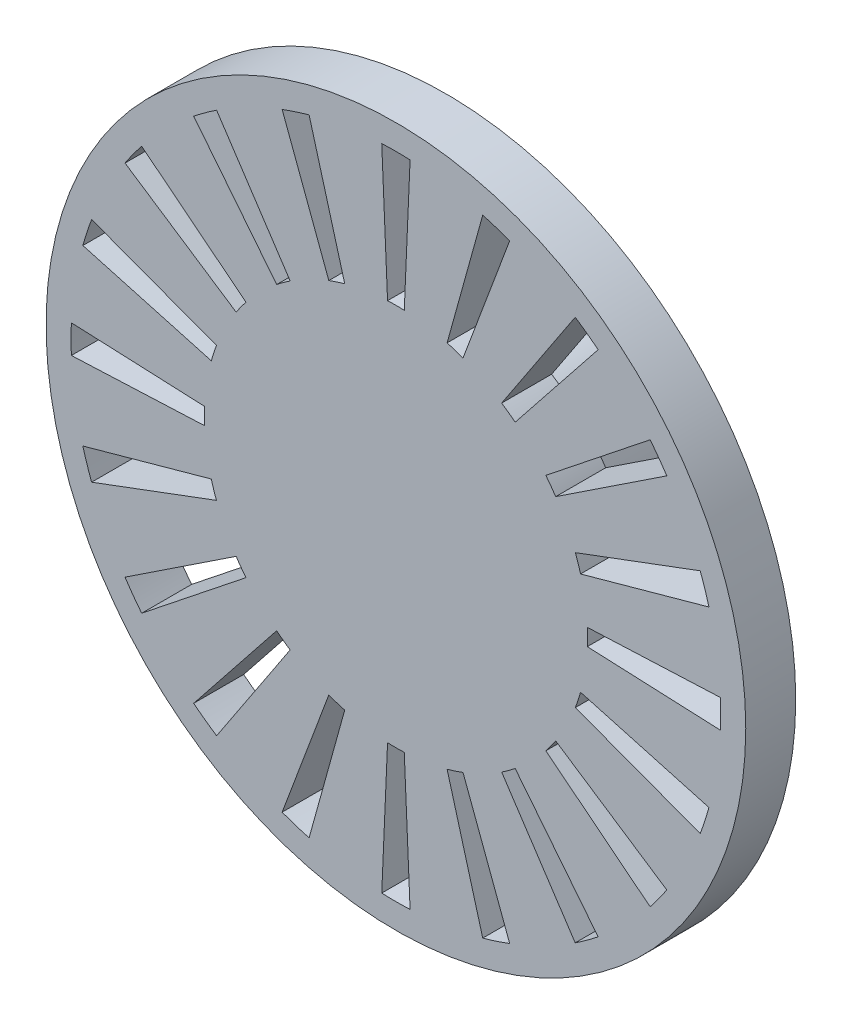
from build123d import *

# Parameters (mm, degrees)
ESBO_O1_R                = 21
RESSALTO_EXTRUS_O1_DEPTH = 3
CORTE_EXTRUS_O1_DEPTH    = 30.849623113
PADR_OCIRCULAR1_COUNT    = 20
ESBO_O7_R                = 6
RESSALTO_EXTRUS_O2_DEPTH = 10
CHANFRO1_SIZE            = 3
ESBO_O8_R                = 1.3
CORTE_EXTRUS_O3_DEPTH    = 12


with BuildPart() as part:
    # Esboço1 → Ressalto-extrusão1 (new body)
    with BuildSketch(Plane.XY):
        Circle(ESBO_O1_R)
    extrude(amount=RESSALTO_EXTRUS_O1_DEPTH)

    # Esboço5 → Corte-extrusão1 (cut, through all)
    with BuildSketch(Plane.XY.offset(3)):
        with BuildLine():
            Line((-0.501622955, 11.489054548), (-0.850578054, 19.481440321))
            ThreePointArc((-0.850578054, 19.481440321), (0, 19.5), (0.850578054, 19.481440321))
            Line((0.850578054, 19.481440321), (0.501622955, 11.489054548))
            ThreePointArc((0.501622955, 11.489054548), (0, 11.5), (-0.501622955, 11.489054548))
        make_face()
    corte_extrus_o1 = extrude(amount=-CORTE_EXTRUS_O1_DEPTH, mode=Mode.SUBTRACT)

    # PadrãoCircular1: Corte-extrusão1 ×20 about axis
    padr_ocircular1_axis = Axis((0, 0, 0), (0, 0, 1))
    for i in range(1, PADR_OCIRCULAR1_COUNT):
        add(corte_extrus_o1.rotate(padr_ocircular1_axis, i * 360 / PADR_OCIRCULAR1_COUNT), mode=Mode.SUBTRACT)

    # Esboço7 → Ressalto-extrusão2 (add)
    with BuildSketch(Plane(origin=(0, 0, 0), x_dir=(-1, 0, 0), z_dir=(0, 0, -1))):
        with Locations(Location((0, 0, 0), (0, 0, 180))):
            Circle(ESBO_O7_R)
    extrude(amount=RESSALTO_EXTRUS_O2_DEPTH)

    # Chanfro1
    chanfro1_edges = [part.edges().sort_by_distance(p)[0] for p in [
        (-6, 0, -10),
    ]]
    chamfer(chanfro1_edges, length=CHANFRO1_SIZE)

    # Esboço8 → Corte-extrusão3 (cut)
    with BuildSketch(Plane(origin=(0, 0, -10), x_dir=(-1, 0, 0), z_dir=(0, 0, -1))):
        Circle(ESBO_O8_R)
    extrude(amount=-CORTE_EXTRUS_O3_DEPTH, mode=Mode.SUBTRACT)


solid = part.part
